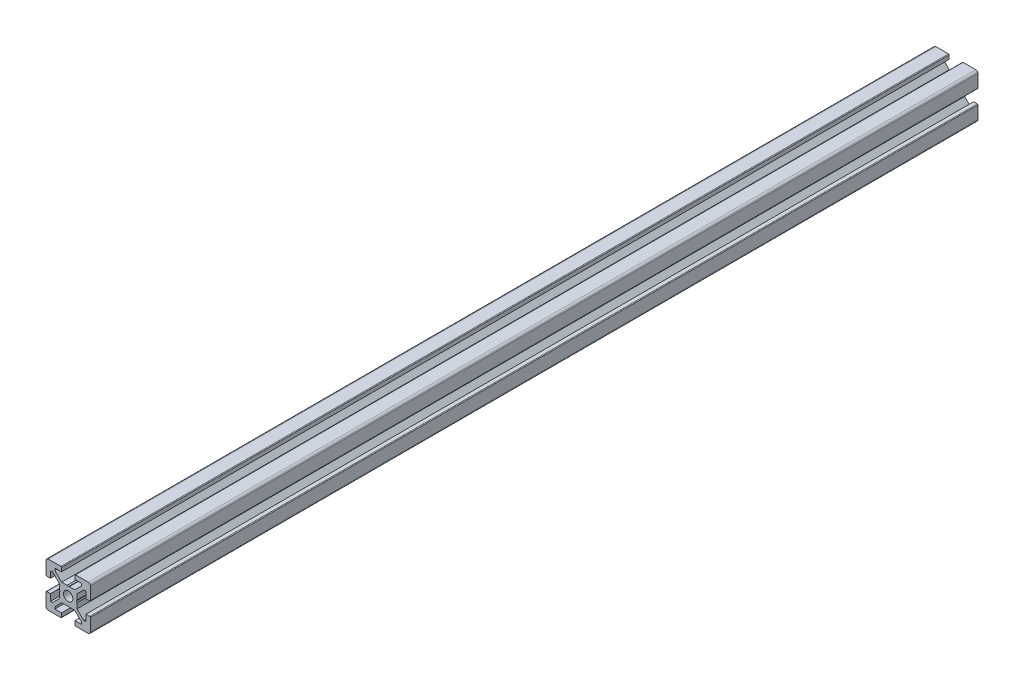
from build123d import *

# Parameters (mm, degrees)
EXTRUDE_1_DEPTH = 400
SKETCH_2_W      = 400
SKETCH_2_H      = 2.1


with BuildPart() as part:
    # 草圖1 → 填料-伸長1 (new body)
    with BuildSketch(Plane.XY):
        with BuildLine():
            Line((-10, 9), (-10, 3.29999995))
            ThreePointArc((-10, 3.29999995), (-9.912132049, 3.087867916), (-9.7, 3))
            Line((-9.7, 3), (-8, 3))
            Line((-8, 3), (-8, 6))
            Line((-8, 6), (-7.060677, 6))
            Line((-7.060677, 6), (-4, 2.93932965))
            Line((-4, 2.93932965), (-4, 0.519615242))
            Line((-4, 0.519615242), (-3.699996283, -6.437e-06))
            Line((-3.699996283, -6.437e-06), (-4, -0.519628117))
            Line((-4, -0.519628117), (-4, -2.93933725))
            Line((-4, -2.93933725), (-7.0606695, -6))
            Line((-7.0606695, -6), (-8, -6))
            Line((-8, -6), (-8, -3))
            Line((-8, -3), (-9.7, -3))
            ThreePointArc((-9.7, -3), (-9.912132049, -3.087867916), (-10, -3.29999995))
            Line((-10, -3.29999995), (-10, -9))
            ThreePointArc((-10, -9), (-9.707106781, -9.707106781), (-9, -10))
            Line((-9, -10), (-3.29999995, -10))
            ThreePointArc((-3.29999995, -10), (-3.087867916, -9.912132049), (-3, -9.7))
            Line((-3, -9.7), (-3, -8))
            Line((-3, -8), (-6, -8))
            Line((-6, -8), (-6, -7.0606515))
            Line((-6, -7.0606515), (-2.9393489, -4))
            Line((-2.9393489, -4), (-0.519615242, -4))
            Line((-0.519615242, -4), (6.437e-06, -3.699996283))
            Line((6.437e-06, -3.699996283), (0.519628117, -4))
            Line((0.519628117, -4), (2.9393227, -4))
            Line((2.9393227, -4), (6, -7.060677))
            Line((6, -7.060677), (6, -8))
            Line((6, -8), (3, -8))
            Line((3, -8), (3, -9.7))
            ThreePointArc((3, -9.7), (3.087867916, -9.912132049), (3.29999995, -10))
            Line((3.29999995, -10), (9, -10))
            ThreePointArc((9, -10), (9.707106781, -9.707106781), (10, -9))
            Line((10, -9), (10, -3.29999995))
            ThreePointArc((10, -3.29999995), (9.912132049, -3.087867916), (9.7, -3))
            Line((9.7, -3), (8, -3))
            Line((8, -3), (8, -6))
            Line((8, -6), (7.0606435, -6))
            Line((7.0606435, -6), (4, -2.9393482))
            Line((4, -2.9393482), (4, -0.519615242))
            Line((4, -0.519615242), (3.699996283, 6.437e-06))
            Line((3.699996283, 6.437e-06), (4, 0.519628117))
            Line((4, 0.519628117), (4, 2.9393401))
            Line((4, 2.9393401), (7.060651, 6))
            Line((7.060651, 6), (8, 6))
            Line((8, 6), (8, 3))
            Line((8, 3), (9.7, 3))
            ThreePointArc((9.7, 3), (9.912132049, 3.087867916), (10, 3.29999995))
            Line((10, 3.29999995), (10, 9))
            ThreePointArc((10, 9), (9.707106781, 9.707106781), (9, 10))
            Line((9, 10), (3.29999995, 10))
            ThreePointArc((3.29999995, 10), (3.087867916, 9.912132049), (3, 9.7))
            Line((3, 9.7), (3, 8))
            Line((3, 8), (6, 8))
            Line((6, 8), (6, 7.060669))
            Line((6, 7.060669), (2.9393308, 4))
            Line((2.9393308, 4), (0.519615242, 4))
            Line((0.519615242, 4), (-6.437e-06, 3.699996283))
            Line((-6.437e-06, 3.699996283), (-0.519628117, 4))
            Line((-0.519628117, 4), (-2.93935655, 4))
            Line((-2.93935655, 4), (-6, 7.0606435))
            Line((-6, 7.0606435), (-6, 8))
            Line((-6, 8), (-3, 8))
            Line((-3, 8), (-3, 9.7))
            ThreePointArc((-3, 9.7), (-3.087867966, 9.912132034), (-3.3, 10))
            Line((-3.3, 10), (-9, 10))
            ThreePointArc((-9, 10), (-9.707106781, 9.707106781), (-10, 9))
        make_face()
    extrude(amount=-EXTRUDE_1_DEPTH)

    # 草圖2 → 除料-旋轉1 (revolve, cut)
    with BuildSketch(Plane(origin=(0, 0, 0), x_dir=(0, 0, -1), z_dir=(1, 0, 0)), mode=Mode.PRIVATE) as cut_revolve_1_sk:
        with Locations((200, 1.05)):
            Rectangle(SKETCH_2_W, SKETCH_2_H)
    revolve(cut_revolve_1_sk.sketch.rotate(Axis((0, 0, -400), (0, 0, 1)), 270), axis=Axis((0, 0, -400), (0, 0, 1)), mode=Mode.SUBTRACT)


solid = part.part
